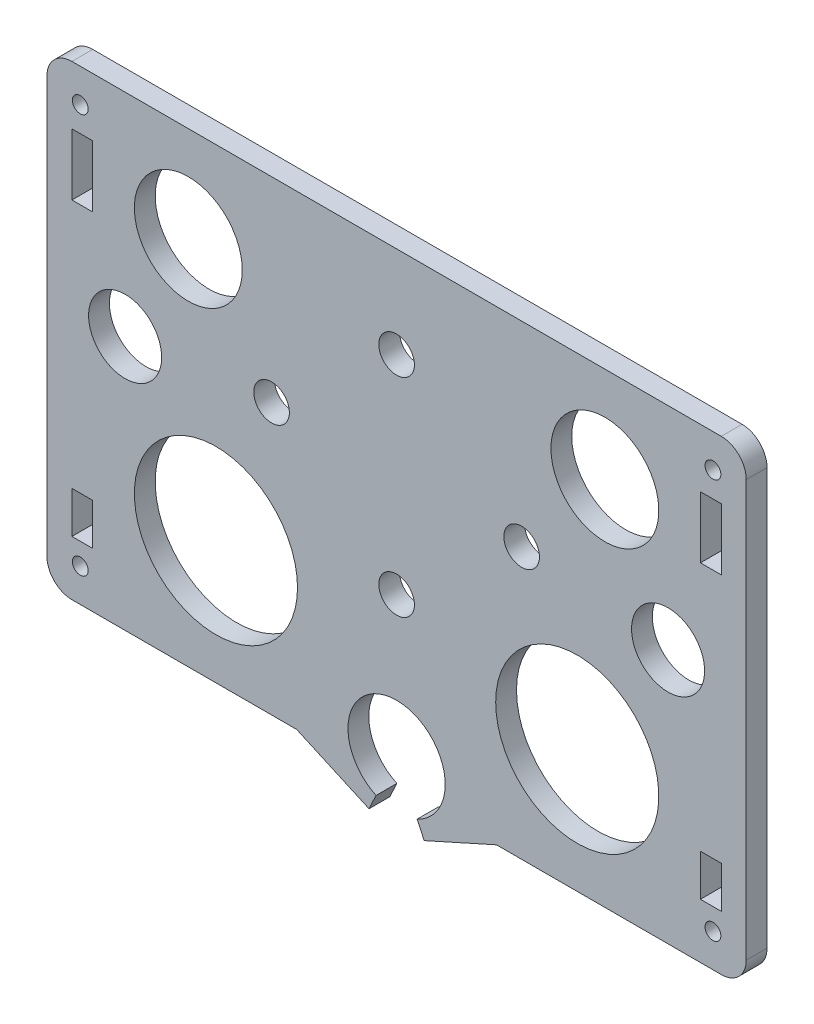
from build123d import *

# Parameters (mm, degrees)
SKETCH1_R           = 0.60325
BOSS_EXTRUDE1_DEPTH = 1.5875
SKETCH5_W           = 1.5875
SKETCH5_H           = 3.175
SKETCH5_H_2         = 4.699
CUT_EXTRUDE1_DEPTH  = 34.530212411
SKETCH7_R           = 1.3589
CUT_EXTRUDE2_DEPTH  = 34.530212411
SKETCH8_R           = 6.222246918
SKETCH8_R_2         = 4.114931659
CUT_EXTRUDE3_DEPTH  = 34.530212411
SKETCH9_R           = 2.787155445
CUT_EXTRUDE4_DEPTH  = 34.530212411


with BuildPart() as part:
    # Sketch1 → Boss-Extrude1 (new body)
    with BuildSketch(Plane.XY):
        with BuildLine():
            ThreePointArc((26.67, 15.875), (26.112038418, 17.222038418), (24.765, 17.78))
            Line((24.765, 17.78), (-24.765, 17.78))
            ThreePointArc((-24.765, 17.78), (-26.112038418, 17.222038418), (-26.67, 15.875))
            Line((-26.67, 15.875), (-26.67, -15.875))
            ThreePointArc((-26.67, -15.875), (-26.112038418, -17.222038418), (-24.765, -17.78))
            Line((-24.765, -17.78), (-7.62, -17.78))
            Line((-7.62, -17.78), (-2.103962754, -20.259962687))
            Line((-2.103962754, -20.259962687), (-1.567237562, -19.108951797))
            ThreePointArc((-1.567237562, -19.108951797), (0, -12.0396), (1.567237562, -19.108951797))
            Line((1.567237562, -19.108951797), (2.103962754, -20.259962687))
            Line((2.103962754, -20.259962687), (7.62, -17.78))
            Line((7.62, -17.78), (24.765, -17.78))
            ThreePointArc((24.765, -17.78), (26.112038418, -17.222038418), (26.67, -15.875))
            Line((26.67, -15.875), (26.67, 15.875))
        make_face()
        with Locations((-24.13, -15.24)):
            Circle(SKETCH1_R, mode=Mode.SUBTRACT)
        with Locations((24.13, -15.24)):
            Circle(SKETCH1_R, mode=Mode.SUBTRACT)
        with Locations((-24.13, 15.24)):
            Circle(SKETCH1_R, mode=Mode.SUBTRACT)
        with Locations((24.13, 15.24)):
            Circle(SKETCH1_R, mode=Mode.SUBTRACT)
    extrude(amount=BOSS_EXTRUDE1_DEPTH)

    # Sketch5 → Cut-Extrude1 (cut, through all)
    with BuildSketch(Plane.XY.offset(1.5875)):
        with Locations((23.97125, -12.011129894)):
            Rectangle(SKETCH5_W, SKETCH5_H)
        with Locations((23.97125, 10.975870106)):
            Rectangle(SKETCH5_W, SKETCH5_H_2)
    cut_extrude1 = extrude(amount=-CUT_EXTRUDE1_DEPTH, mode=Mode.SUBTRACT)

    # Mirror1: Cut-Extrude1 across plane
    add(cut_extrude1.mirror(Plane(origin=(0, 0, 0), x_dir=(0, 0, 1), z_dir=(1, 0, 0))), mode=Mode.SUBTRACT)

    # Sketch7 → Cut-Extrude2 (cut, through all)
    with BuildSketch(Plane.XY.offset(1.5875)):
        with Locations((0, 10.795)):
            Circle(SKETCH7_R)
        with Locations((9.5377, 2.8702)):
            Circle(SKETCH7_R)
        with Locations((-9.5377, 2.8702)):
            Circle(SKETCH7_R)
        with Locations((0, -5.0546)):
            Circle(SKETCH7_R)
    extrude(amount=-CUT_EXTRUDE2_DEPTH, mode=Mode.SUBTRACT)

    # Sketch8 → Cut-Extrude3 (cut, through all)
    with BuildSketch(Plane.XY.offset(1.5875)):
        with Locations((13.780253082, -8.382753082)):
            Circle(SKETCH8_R)
        with Locations((-15.887568341, 10.490068341)):
            Circle(SKETCH8_R_2)
        with Locations((-13.780253082, -8.382753082)):
            Circle(SKETCH8_R)
        with Locations((15.887568341, 10.490068341)):
            Circle(SKETCH8_R_2)
    extrude(amount=-CUT_EXTRUDE3_DEPTH, mode=Mode.SUBTRACT)

    # Sketch9 → Cut-Extrude4 (cut, through all)
    with BuildSketch(Plane.XY.offset(1.5875)):
        with Locations((-20.707844555, 1.640626454)):
            Circle(SKETCH9_R)
        with Locations((20.707844555, 1.640626454)):
            Circle(SKETCH9_R)
    extrude(amount=-CUT_EXTRUDE4_DEPTH, mode=Mode.SUBTRACT)


solid = part.part
